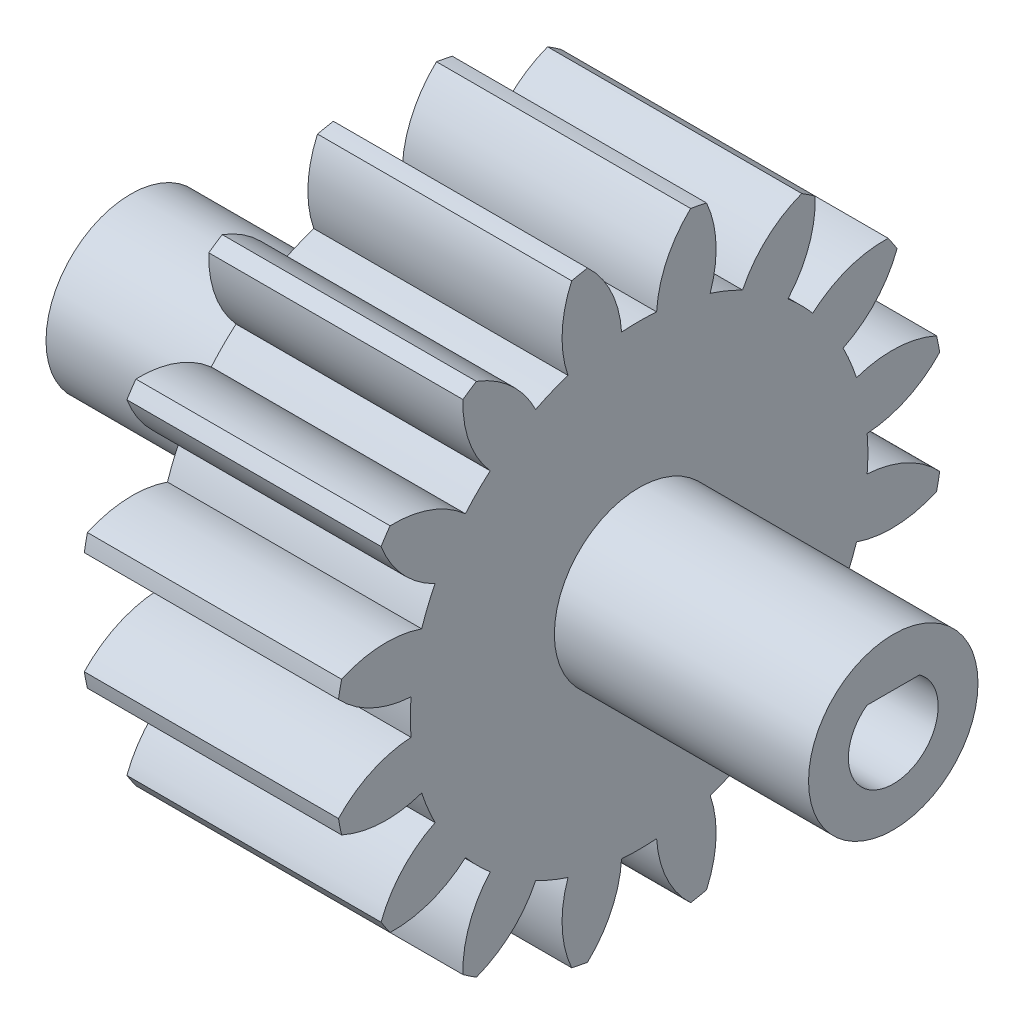
from build123d import *

# Parameters (mm, degrees)
BASPROSKE_W         = 15
BASPROSKE_H         = 18
TOOTHCUT_DEPTH      = 30.546573405
TEETHCUTS_COUNT     = 16
TEETHCUTS_ANGLE     = 337.5
HUBNEABOTSKE_R      = 5
HUBNEARBOTH_DEPTH   = 15.0000254
HUBFAR_START        = 15.0000254
HUBFARSKE_R         = 5
HUBFAR_DEPTH        = 15.0000254
BORSKE_R            = 2.5
BORE_DEPTH          = 45.0000508
BOSS_EXTRUDE1_DEPTH = 45.0000508
CUT_EXTRUDE1_DEPTH  = 52.521769281


with BuildPart() as part:
    # BasProSke → Base-Revolve (revolve)
    with BuildSketch(Plane(origin=(0, 0, 0), x_dir=(1, 0, 0), z_dir=(0, 1, 0)), mode=Mode.PRIVATE) as base_revolve_sk:
        with Locations((7.5, 9)):
            Rectangle(BASPROSKE_W, BASPROSKE_H)
    revolve(base_revolve_sk.sketch.rotate(Axis((-10, 0, 0), (1, 0, 0)), 180), axis=Axis((-10, 0, 0), (1, 0, 0)))

    # TooCutSke → ToothCut (cut, through all)
    with BuildSketch(Plane(origin=(0, 0, 0), x_dir=(0, 0, -1), z_dir=(1, 0, 0))):
        with BuildLine():
            ThreePointArc((1.03434411, 13.459313997), (0, 13.499), (-1.03434411, 13.459313997))
            ThreePointArc((-1.03434411, 13.459313997), (-1.635143665, 15.806872195), (-3.065655864, 17.762792553))
            ThreePointArc((-3.065655864, 17.762792553), (0, 18.0254), (3.065655864, 17.762792553))
            ThreePointArc((3.065655864, 17.762792553), (1.635143665, 15.806872195), (1.03434411, 13.459313997))
        make_face()
    toothcut = extrude(amount=TOOTHCUT_DEPTH, mode=Mode.SUBTRACT)

    # TeethCuts: ToothCut ×16 about axis
    teethcuts_axis = Axis((-10, 0, 0), (1, 0, 0))
    for i in range(1, TEETHCUTS_COUNT):
        add(toothcut.rotate(teethcuts_axis, i * TEETHCUTS_ANGLE / (TEETHCUTS_COUNT - 1)), mode=Mode.SUBTRACT)

    # HubNeaBotSke → HubNearBoth (add)
    with BuildSketch(Plane.ZY):
        with Locations(Location((0, 0, 0), (0, 0, 180))):
            Circle(HUBNEABOTSKE_R)
    extrude(amount=HUBNEARBOTH_DEPTH)

    # HubFarSke → HubFar (add)
    with BuildSketch(Plane(origin=(15, 0, 0), x_dir=(0, 0, -1), z_dir=(1, 0, 0)).offset(HUBFAR_START)):
        Circle(HUBFARSKE_R)
    extrude(amount=-HUBFAR_DEPTH)

    # BorSke → Bore (cut, symmetric)
    with BuildSketch(Plane(origin=(0, 0, 0), x_dir=(0, 0, -1), z_dir=(1, 0, 0))):
        with Locations(Location((0, 0, 0), (0, 0, 180))):
            Circle(BORSKE_R)
    extrude(amount=BORE_DEPTH, both=True, mode=Mode.SUBTRACT)

    # Sketch1 → Boss-Extrude1 (add)
    with BuildSketch(Plane(origin=(30.0000254, 0, 0), x_dir=(0, 0, -1), z_dir=(1, 0, 0))):
        with BuildLine():
            Line((-1.5, 2), (1.5, 2))
            ThreePointArc((1.5, 2), (0, 2.5), (-1.5, 2))
        make_face()
    extrude(amount=-BOSS_EXTRUDE1_DEPTH)

    # Sketch2 → Cut-Extrude1 (cut, through all)
    with BuildSketch(Plane(origin=(30.0000254, 0, 0), x_dir=(0, 0, -1), z_dir=(1, 0, 0))):
        with BuildLine():
            Line((-1.549193338, 2.15), (1.549193338, 2.15))
            ThreePointArc((1.549193338, 2.15), (0, -2.65), (-1.549193338, 2.15))
        make_face()
        with BuildLine():
            Line((-1.5, 2), (1.5, 2))
            ThreePointArc((1.5, 2), (0, -2.5), (-1.5, 2))
        make_face(mode=Mode.SUBTRACT)
    extrude(amount=-CUT_EXTRUDE1_DEPTH, mode=Mode.SUBTRACT)


solid = part.part
